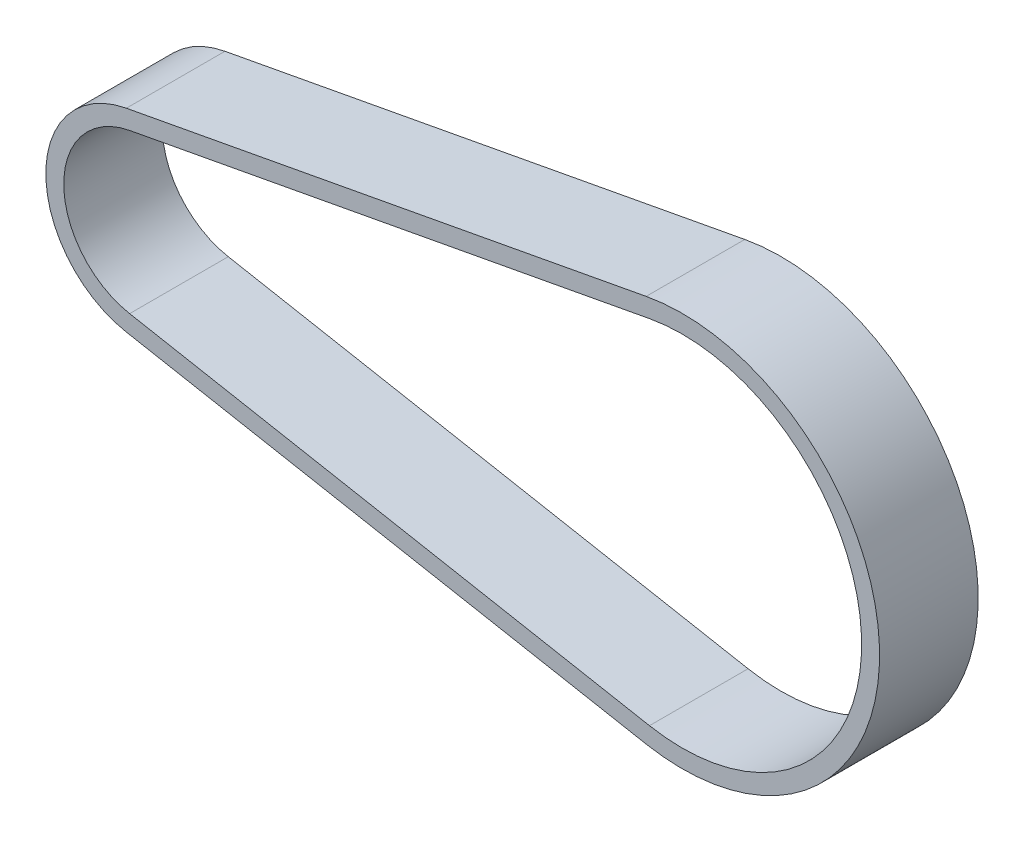
from build123d import *

# Parameters (mm, degrees)
EXTRUDE_1_DEPTH = 11


with BuildPart() as part:
    # 草图1 → 凸台-拉伸1 (new body)
    with BuildSketch(Plane.XY):
        with BuildLine():
            Line((-62.016666667, 10.813558876), (-4.033333333, 21.627117751))
            ThreePointArc((-4.033333333, 21.627117751), (22, 0), (-4.033333333, -21.627117751))
            Line((-4.033333333, -21.627117751), (-62.016666667, -10.813558876))
            ThreePointArc((-62.016666667, -10.813558876), (-71, 0), (-62.016666667, 10.813558876))
        make_face()
        with BuildLine():
            Line((-61.65, 8.847457262), (-3.666666667, 19.661016137))
            ThreePointArc((-3.666666667, 19.661016137), (20, 0), (-3.666666667, -19.661016137))
            Line((-3.666666667, -19.661016137), (-61.65, -8.847457262))
            ThreePointArc((-61.65, -8.847457262), (-69, 0), (-61.65, 8.847457262))
        make_face(mode=Mode.SUBTRACT)
    extrude(amount=EXTRUDE_1_DEPTH)


solid = part.part
